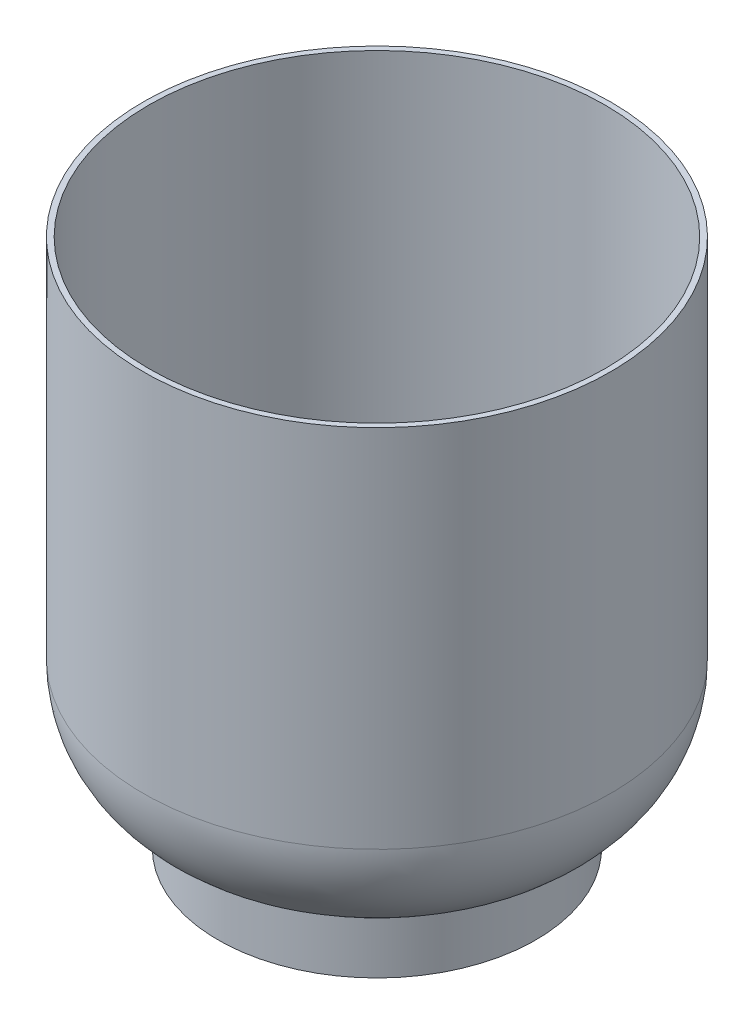
from build123d import *


with BuildPart() as part:
    # Çizim1 → Döndür1 (revolve)
    with BuildSketch(Plane.XY, mode=Mode.PRIVATE) as d_nd_r1_sk:
        with BuildLine():
            Line((-62.5, 208.714063436), (-62.5, 108.714063436))
            ThreePointArc((-62.5, 108.714063436), (-57.140269015, 91.600994078), (-42.976190476, 80.602687925))
            ThreePointArc((-42.976190476, 80.602687925), (-42.267986549, 80.052772618), (-42, 79.19711915))
            Line((-42, 79.19711915), (-42, 63.714063436))
            Line((-42, 63.714063436), (-43.5, 63.714063436))
            Line((-43.5, 63.714063436), (-43.5, 78.173107328))
            ThreePointArc((-43.5, 78.173107328), (-43.754553749, 79.009087972), (-44.431818182, 79.561332606))
            ThreePointArc((-44.431818182, 79.561332606), (-58.654371267, 91.158469922), (-64, 108.714063436))
            Line((-64, 108.714063436), (-64, 208.714063436))
            Line((-64, 208.714063436), (-62.5, 208.714063436))
        make_face()
    revolve(d_nd_r1_sk.sketch.rotate(Axis((0, 0, 0), (0, 1, 0)), 270), axis=Axis((0, 0, 0), (0, 1, 0)))


solid = part.part
